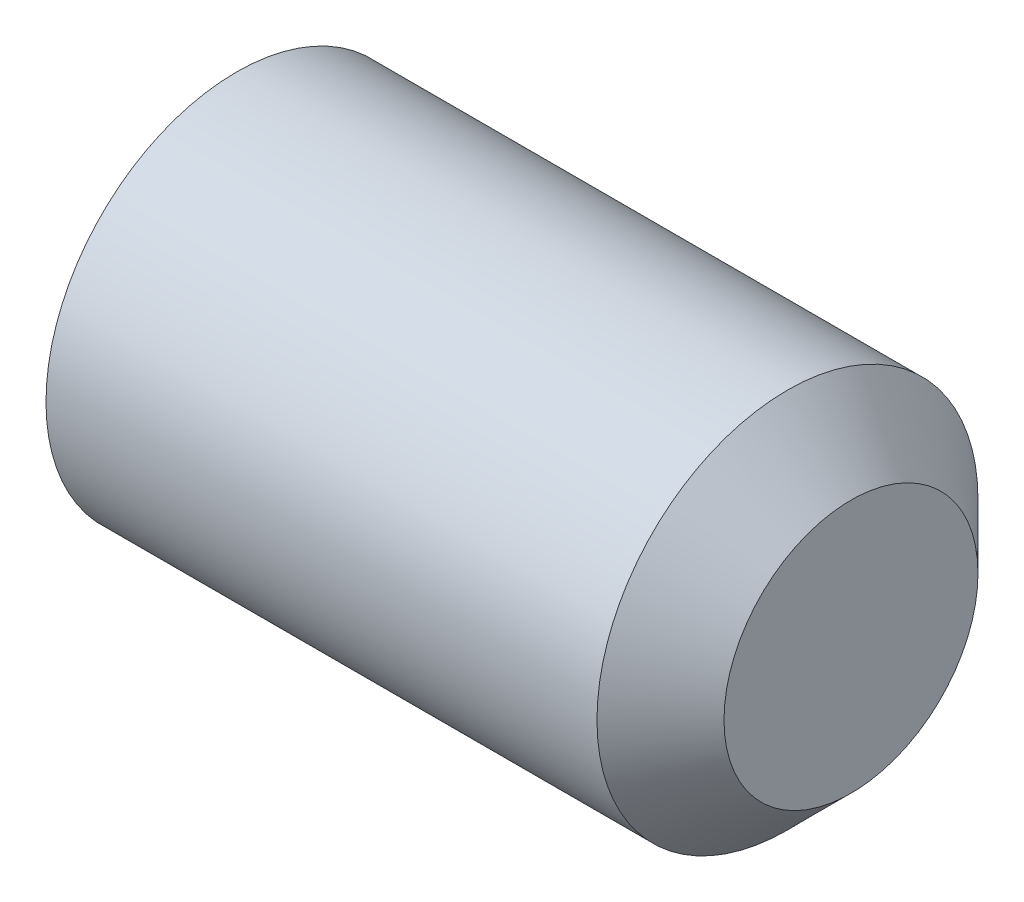
from build123d import *

# Parameters (mm, degrees)
ESQUISSE1_W             = 5
ESQUISSE1_H             = 1.5
ENL_V_MAT_EXTRU_1_DEPTH = 2
CHANFREIN1_SIZE         = 0.5
CHANFREIN2_SIZE         = 0.2805
CHANFREIN2_SIZE2        = 0.161946751


with BuildPart() as part:
    # Esquisse1 → Révolution1 (revolve)
    with BuildSketch(Plane(origin=(0, 0, 0), x_dir=(-1, 0, 0), z_dir=(0, 0, -1)), mode=Mode.PRIVATE) as r_volution1_sk:
        with Locations((-2.5, 0.75)):
            Rectangle(ESQUISSE1_W, ESQUISSE1_H)
    revolve(r_volution1_sk.sketch.rotate(Axis((5, 0, 0), (-1, 0, 0)), 270), axis=Axis((5, 0, 0), (-1, 0, 0)))

    # Esquisse2 → Enlèv. mat.-Extru.1 (cut)
    with BuildSketch(Plane.ZY):
        Polygon((0.433012702, -0.75), (0.866025404, 0), (0.433012702, 0.75), (-0.433012702, 0.75), (-0.866025404, 0), (-0.433012702, -0.75), align=None)
    extrude(amount=-ENL_V_MAT_EXTRU_1_DEPTH, mode=Mode.SUBTRACT)

    # Chanfrein1
    chanfrein1_edges = [part.edges().sort_by_distance(p)[0] for p in [
        (5, 0, -1.5),
    ]]
    chamfer(chanfrein1_edges, length=CHANFREIN1_SIZE)

    # Chanfrein2
    chanfrein2_edges = [part.edges().sort_by_distance(p)[0] for p in [
        (0, 0, -1.5),
    ]]
    chanfrein2_side = [part.faces().sort_by_distance(p)[0] for p in [
        (0, 0, -1.457573593),
    ]]
    chamfer(chanfrein2_edges, length=CHANFREIN2_SIZE, length2=CHANFREIN2_SIZE2, reference=chanfrein2_side[0])


solid = part.part
